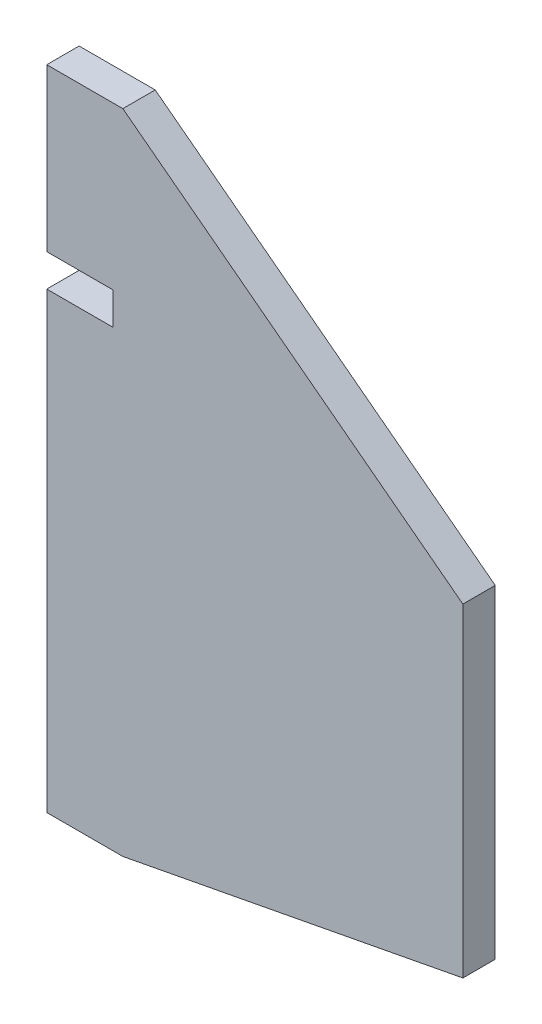
from build123d import *

# Parameters (mm, degrees)
BOSS_EXTRUDE1_DEPTH = 5.08
SKETCH3_W           = 10.414
SKETCH3_H           = 5.08
CUT_EXTRUDE1_DEPTH  = 121.870110797


with BuildPart() as part:
    # Sketch2 → Boss-Extrude1 (new body)
    with BuildSketch(Plane.XY):
        Polygon((0, 0), (11.938, 0), (65.278, 10.16), (65.278, 60.96), (11.938, 101.6), (0, 101.6), align=None)
    extrude(amount=BOSS_EXTRUDE1_DEPTH)

    # Sketch3 → Cut-Extrude1 (cut, through all)
    with BuildSketch(Plane.XY.offset(5.08)):
        with Locations((5.207, 73.66)):
            Rectangle(SKETCH3_W, SKETCH3_H)
    extrude(amount=-CUT_EXTRUDE1_DEPTH, mode=Mode.SUBTRACT)


solid = part.part
